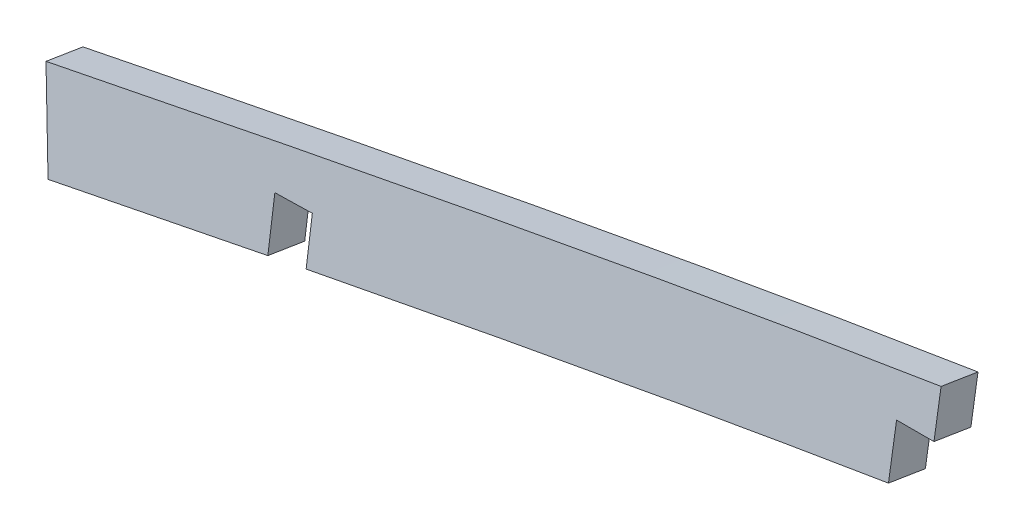
from build123d import *

# Parameters (mm, degrees)
BOSS_EXTRUDE1_DEPTH = 3.175
CUT_EXTRUDE1_DEPTH  = 401.46617672


with BuildPart() as part:
    # Sketch3 → Boss-Extrude1 (new body)
    with BuildSketch(Plane(origin=(0, -90.186626134, -561.928406554), x_dir=(1, 0, 0), z_dir=(0, 0.15846690258874493, 0.9873642898059101))):
        with BuildLine():
            Line((374.396, 137.827848871), (374.396, 141.63269915))
            add(Edge.make_bspline(
                [(374.396, 141.63269915), (365.378247241, 140.351869422), (356.378821901, 138.957098969), (338.401992935, 136.030650092), (329.424670358, 134.498314058), (313.750786532, 131.748061478), (307.051747759, 130.548427396), (300.355738535, 129.33221679)],
                knots=[0, 0, 0, 0, 0.25, 0.25, 0.5, 0.5, 0.68681431, 0.68681431, 0.68681431, 0.68681431], degree=3))
            Line((300.355738535, 129.33221679), (301.717495498, 121.834882733))
            add(Edge.make_bspline(
                [(371.221, 133.4767647), (366.485652047, 132.785360934), (355.611621495, 131.127793525), (338.582430164, 128.339546997), (320.149202977, 125.153673819), (307.858393043, 122.950267206), (301.717495498, 121.834882733)],
                knots=[0.039503599, 0.039503599, 0.039503599, 0.039503599, 0.171703578, 0.343407155, 0.515110733, 0.68681431, 0.68681431, 0.68681431, 0.68681431], degree=3))
            Line((371.221, 133.4767647), (371.221, 137.827848871))
            Line((371.221, 137.827848871), (374.396, 137.827848871))
        make_face()
    extrude(amount=BOSS_EXTRUDE1_DEPTH)

    # Sketch4 → Cut-Extrude1 (cut, through all)
    with BuildSketch(Plane(origin=(0, -90.186626134, -561.928406554), x_dir=(-1, 0, 0), z_dir=(-9.1104866082071e-14, -0.158466902588134, -0.9873642898060083))):
        Polygon((-323.025447556, 125.638791395), (-323.025447556, 123.807923692), (-319.861053503, 123.734597093), (-319.861053503, 125.083150774), (-319.773665288, 129.384296303), (-322.948038155, 129.448791395), align=None)
    extrude(amount=-CUT_EXTRUDE1_DEPTH, mode=Mode.SUBTRACT)


solid = part.part
